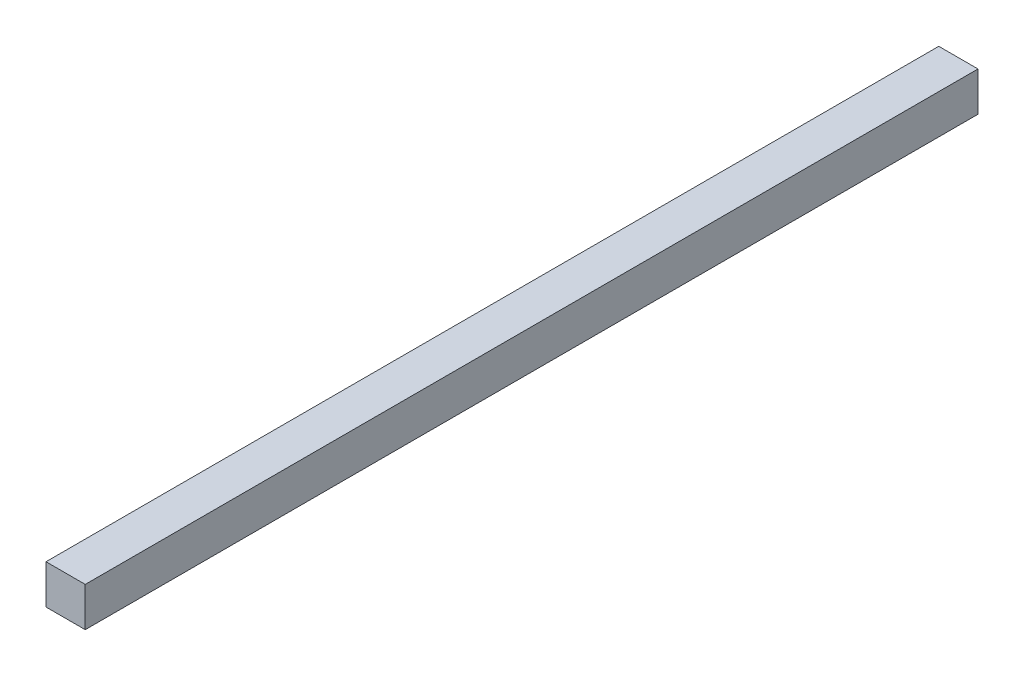
from build123d import *

# Parameters (mm, degrees)
SKETCH3_W           = 40
SKETCH3_H           = 40
BOSS_EXTRUDE1_DEPTH = 910


with BuildPart() as part:
    # Sketch3 → Boss-Extrude1 (new body)
    with BuildSketch(Plane.XY):
        Rectangle(SKETCH3_W, SKETCH3_H)
    extrude(amount=BOSS_EXTRUDE1_DEPTH)


solid = part.part
